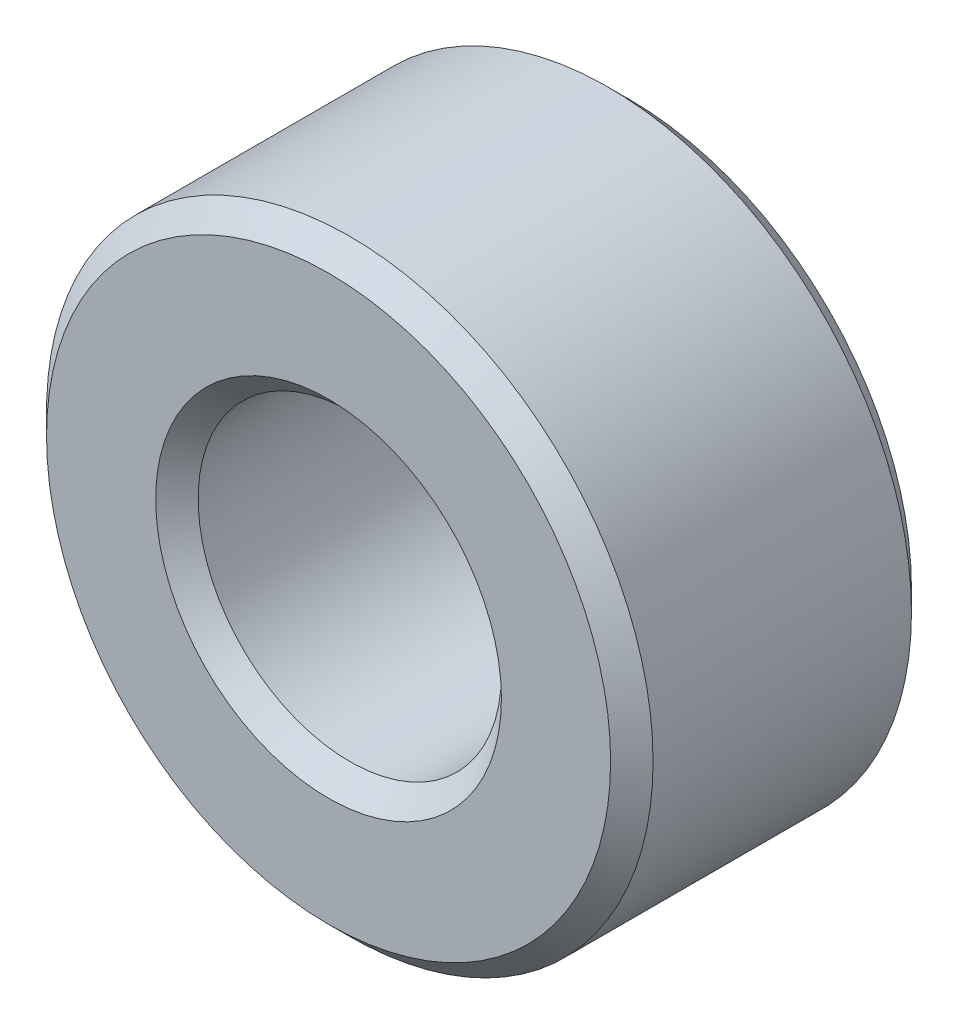
from build123d import *

# Parameters (mm, degrees)
BOSS_EXTRUDE1_DEPTH      = 1.5875
BOSS_EXTRUDE1_DEPTH_BACK = 1.5875
SKETCH14_R               = 3.2004
SKETCH14_R_2             = 1.6002
CHAMFER1_SIZE            = 0.224028


with BuildPart() as part:
    # Sketch14 → Boss-Extrude1 (new, two sides: drawn at the far end of the back side and taken through both)
    with BuildSketch(Plane.XY.offset(-BOSS_EXTRUDE1_DEPTH_BACK)):
        Circle(SKETCH14_R)
        Circle(SKETCH14_R_2, mode=Mode.SUBTRACT)
    extrude(amount=BOSS_EXTRUDE1_DEPTH + BOSS_EXTRUDE1_DEPTH_BACK)

    # Chamfer1
    chamfer1_edges = [part.edges().sort_by_distance(p)[0] for p in [
        (-3.2004, 0, -1.5875),
        (-1.6002, 0, -1.5875),
        (-3.2004, 0, 1.5875),
        (-1.6002, 0, 1.5875),
    ]]
    chamfer(chamfer1_edges, length=CHAMFER1_SIZE)


solid = part.part
